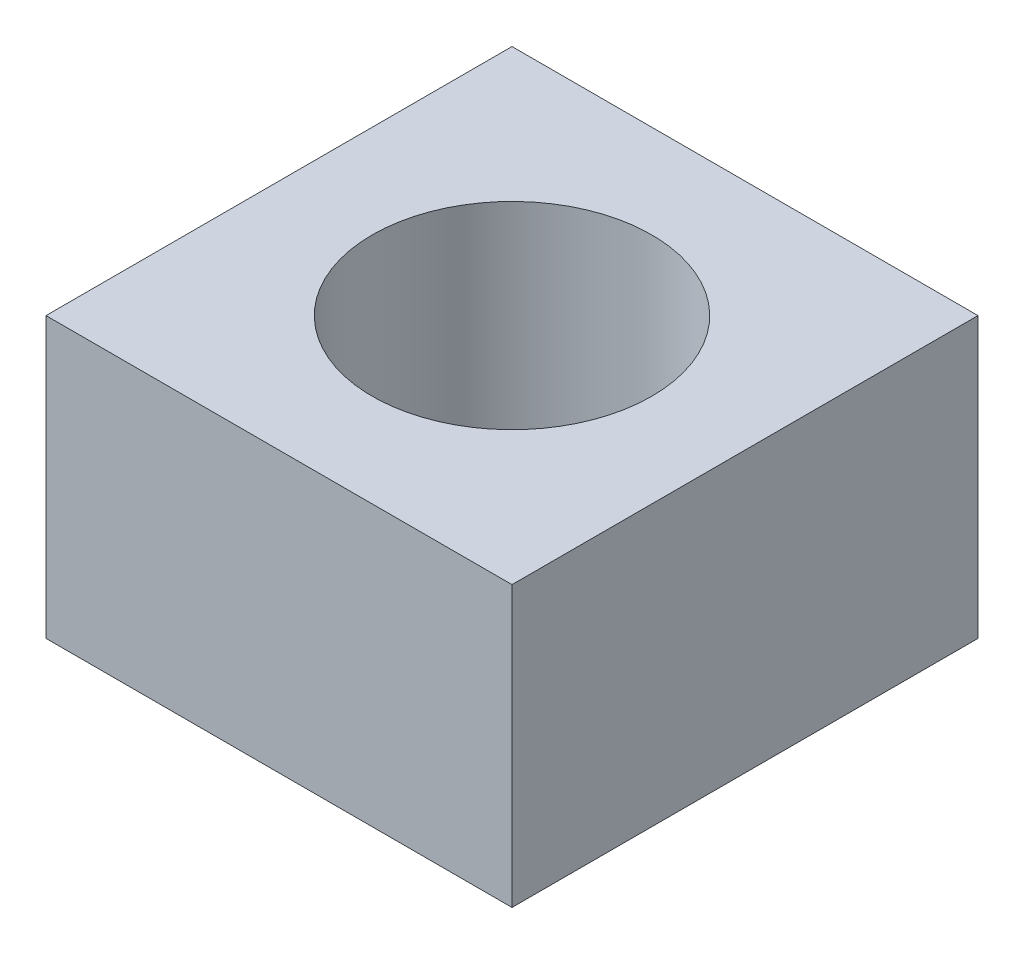
from build123d import *

# Parameters (mm, degrees)
SKETCH1_W           = 5
SKETCH1_H           = 3
BOSS_EXTRUDE1_DEPTH = 5
SKETCH2_R           = 1.5
CUT_EXTRUDE1_DEPTH  = 8.681145748


with BuildPart() as part:
    # Sketch1 → Boss-Extrude1 (new body)
    with BuildSketch(Plane.XY):
        with Locations((2.5, 1.5)):
            Rectangle(SKETCH1_W, SKETCH1_H)
    extrude(amount=BOSS_EXTRUDE1_DEPTH)

    # Sketch2 → Cut-Extrude1 (cut, through all)
    with BuildSketch(Plane(origin=(0, 3, 0), x_dir=(1, 0, 0), z_dir=(0, 1, 0))):
        with Locations(Location((2.5, -2.5, 0), (0, 0, 180))):
            Circle(SKETCH2_R)
    extrude(amount=-CUT_EXTRUDE1_DEPTH, mode=Mode.SUBTRACT)


solid = part.part
